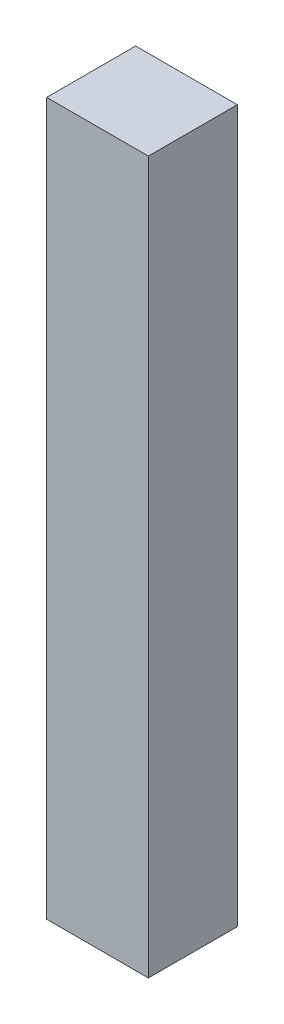
from build123d import *

# Parameters (mm, degrees)
SKETCH1_W           = 8
SKETCH1_H           = 7
BOSS_EXTRUDE1_DEPTH = 28


with BuildPart() as part:
    # Sketch1 → Boss-Extrude1 (new, symmetric)
    with BuildSketch(Plane(origin=(0, 0, 0), x_dir=(1, 0, 0), z_dir=(0, 1, 0))):
        Rectangle(SKETCH1_W, SKETCH1_H)
    extrude(amount=BOSS_EXTRUDE1_DEPTH, both=True)


solid = part.part
